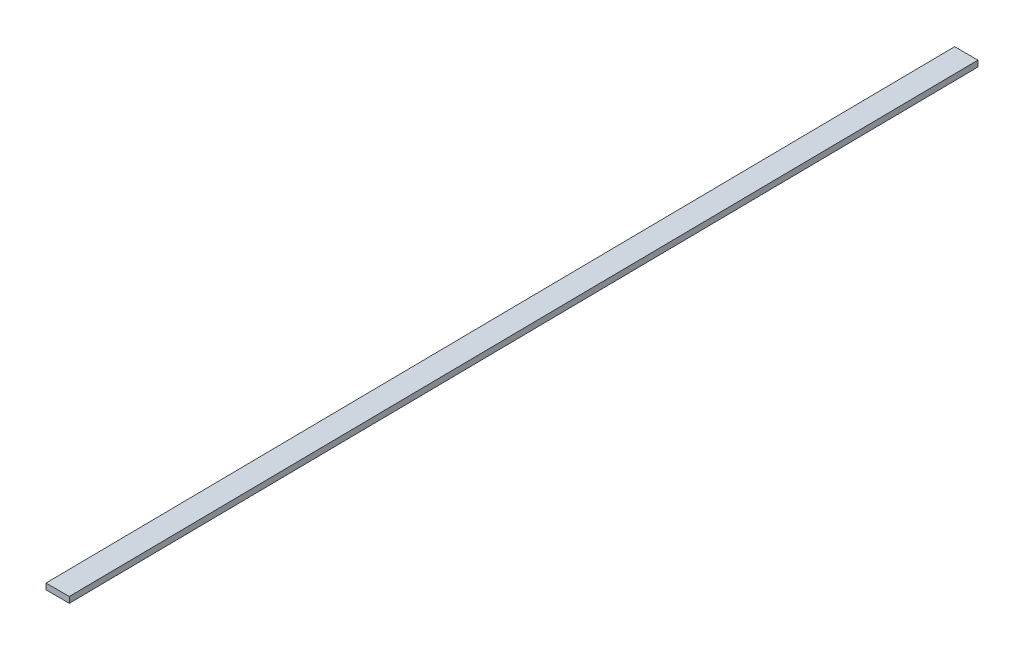
from build123d import *

# Parameters (mm, degrees)
BOSS_EXTRUDE1_DEPTH = 4.7625


with BuildPart() as part:
    # Sketch1 → Boss-Extrude1 (new body)
    with BuildSketch(Plane(origin=(0, 370.547396002, 4.147387745), x_dir=(0.999999999586688, -3.217790098619277e-07, 2.8749270993239413e-05), z_dir=(0, -0.9999373687685194, -0.011191896188322104))):
        Polygon((238.531516139, 775.950547785), (238.552147763, 1493.545491343), (238.552239053, 1496.720690209), (257.094239046, 1496.720157106), (257.094147755, 1493.544958241), (257.073516131, 775.950014682), (257.073424841, 772.774815817), (238.531424849, 772.77534892), align=None)
    extrude(amount=BOSS_EXTRUDE1_DEPTH)


solid = part.part
